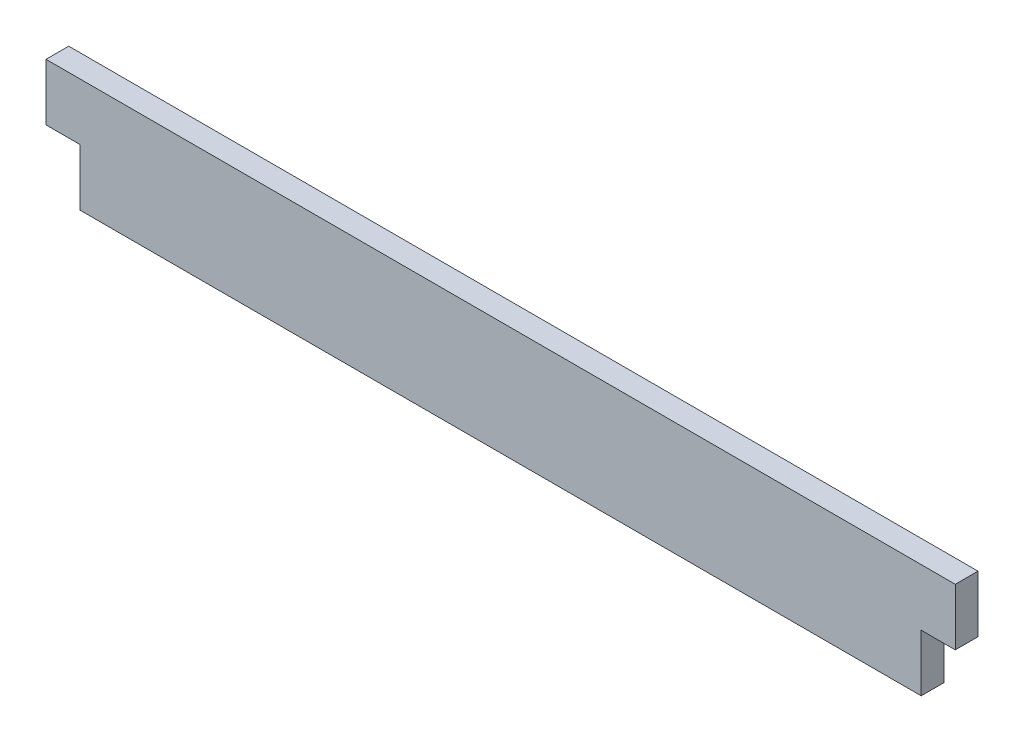
from build123d import *

# Parameters (mm, degrees)
SKETCH1_W           = 80
SKETCH1_H           = 10
BOSS_EXTRUDE2_DEPTH = 2
SKETCH4_W           = 3
SKETCH4_H           = 5
CUT_EXTRUDE3_DEPTH  = 41.360872141


with BuildPart() as part:
    # Sketch1 → Boss-Extrude2 (new body)
    with BuildSketch(Plane.XY):
        Rectangle(SKETCH1_W, SKETCH1_H)
    extrude(amount=BOSS_EXTRUDE2_DEPTH)

    # Sketch4 → Cut-Extrude3 (cut, through all)
    with BuildSketch(Plane(origin=(0, 0, 0), x_dir=(-1, 0, 0), z_dir=(0, 0, -1))):
        with Locations((38.5, -2.5)):
            Rectangle(SKETCH4_W, SKETCH4_H)
        with Locations((-38.5, -2.5)):
            Rectangle(SKETCH4_W, SKETCH4_H)
    extrude(amount=-CUT_EXTRUDE3_DEPTH, mode=Mode.SUBTRACT)


solid = part.part
